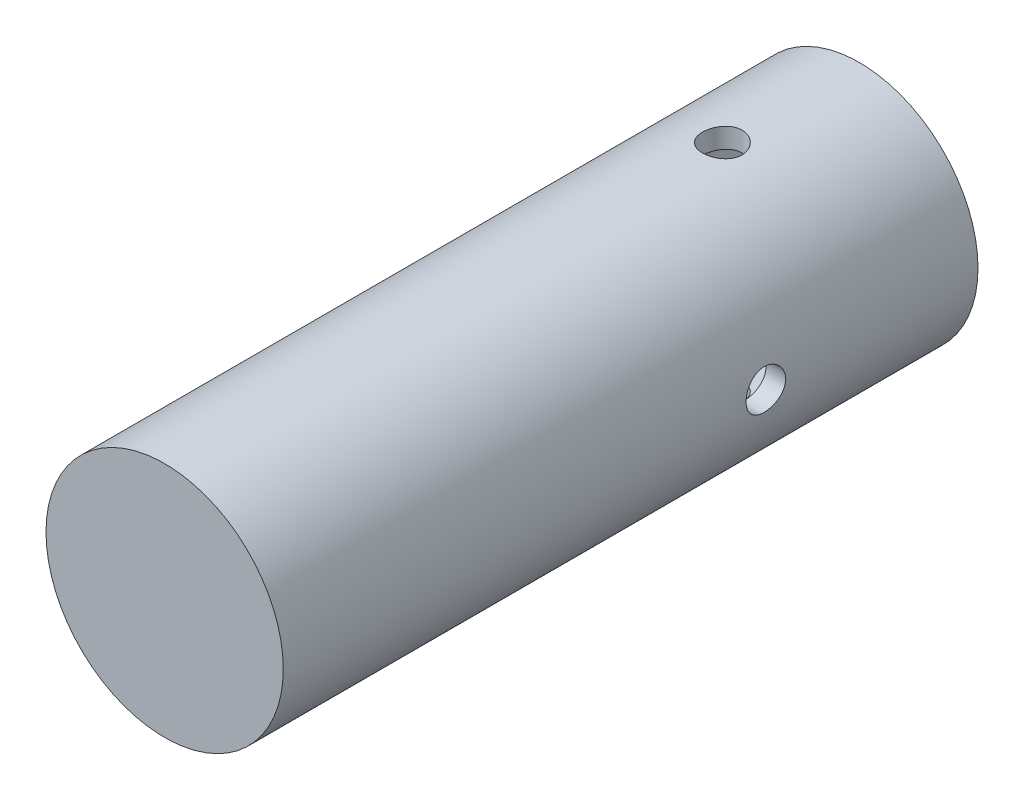
from build123d import *

# Parameters (mm, degrees)
SKETCH5_W               = 1.587499994
SKETCH5_H               = 55.780081988
CUT_EXTRUDE5_DEPTH      = 80.097038204
CUT_EXTRUDE5_DEPTH_BACK = 80.097038204
SKETCH7_R               = 1.5875
CUT_EXTRUDE6_DEPTH      = 80.097038326
CUT_EXTRUDE6_DEPTH_BACK = 80.097038326
SKETCH6_R               = 1.5875
SKETCH10_R              = 7.9375
BOSS_EXTRUDE1_DEPTH     = 30.380081988


with BuildPart() as part:
    # Sketch5 → Revolve2 (revolve)
    with BuildSketch(Plane(origin=(0, 0, 0), x_dir=(1, 0, 0), z_dir=(0, 1, 0)), mode=Mode.PRIVATE) as revolve2_sk:
        with Locations((8.731249997, -50.051540994)):
            Rectangle(SKETCH5_W, SKETCH5_H)
    revolve(revolve2_sk.sketch.rotate(Axis((0, 0, 0), (0, 0, 1)), 180), axis=Axis((0, 0, 0), (0, 0, 1)))

    # Sketch7 → Cut-Extrude5 (cut, two sides: drawn at the far end of the back side and taken through both)
    with BuildSketch(Plane(origin=(0, 0, 0), x_dir=(0, 0, -1), z_dir=(1, 0, 0)).offset(-CUT_EXTRUDE5_DEPTH_BACK)):
        with Locations((-39.195999993, 0)):
            Circle(SKETCH7_R)
    extrude(amount=CUT_EXTRUDE5_DEPTH + CUT_EXTRUDE5_DEPTH_BACK, mode=Mode.SUBTRACT)

    # Sketch6 → Cut-Extrude6 (cut, two sides: drawn at the far end of the back side and taken through both)
    with BuildSketch(Plane(origin=(0, 0, 0), x_dir=(1, 0, 0), z_dir=(0, 1, 0)).offset(-CUT_EXTRUDE6_DEPTH_BACK)):
        with Locations(Location((1e-09, -33.163499999, 0), (0, 0, 269.999999955))):
            Circle(SKETCH6_R)
    extrude(amount=CUT_EXTRUDE6_DEPTH + CUT_EXTRUDE6_DEPTH_BACK, mode=Mode.SUBTRACT)

    # Sketch10 → Boss-Extrude1 (add)
    with BuildSketch(Plane(origin=(0, 0, 47.5615), x_dir=(-1, 0, 0), z_dir=(0, 0, -1))):
        Circle(SKETCH10_R)
    extrude(amount=-BOSS_EXTRUDE1_DEPTH)


solid = part.part
